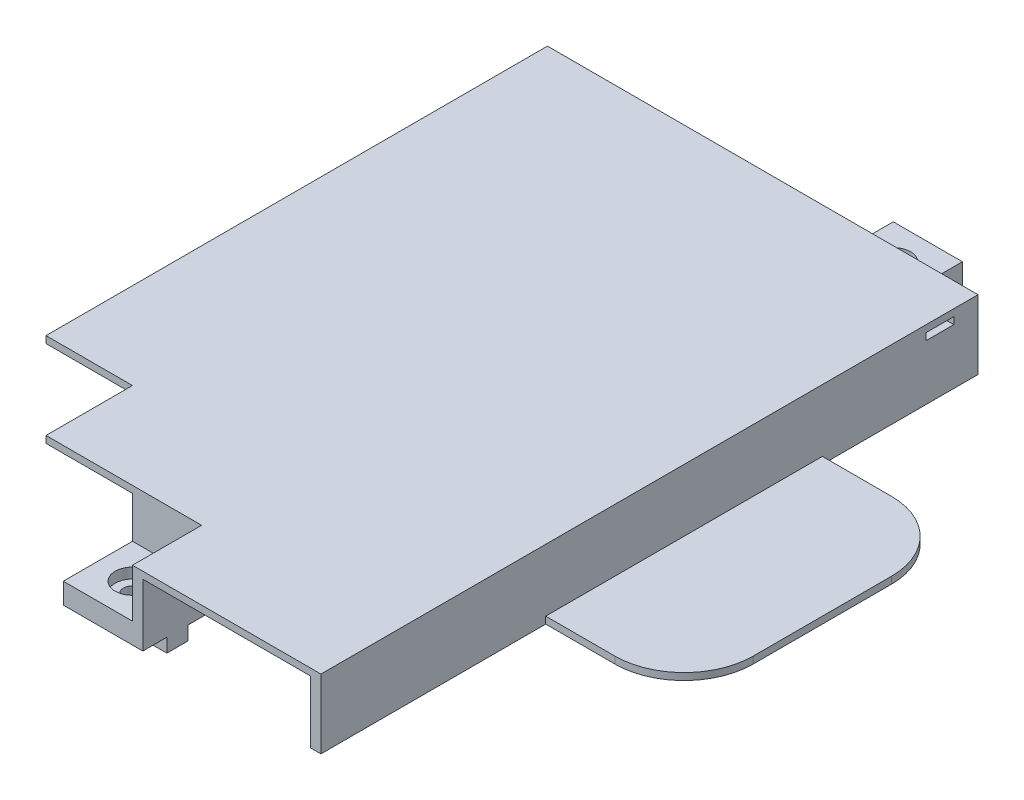
from build123d import *

# Parameters (mm, degrees)
SKETCH_1_W           = 180
SKETCH_1_H           = 170
EXTRUDE_1_DEPTH      = 2
SKETCH_2_W           = 180
SKETCH_2_H           = 2
SKETCH_2_W_2         = 2
SKETCH_2_H_2         = 166
EXTRUDE_2_DEPTH      = 18
SKETCH_4_W           = 20
SKETCH_4_H           = 20
EXTRUDE_3_DEPTH      = 20
SKETCH_5_W           = 20
SKETCH_5_H           = 20
CUT_EXTRUDE_1_DEPTH  = 14
SKETCH_6_W           = 176
SKETCH_6_H           = 166
SKETCH_6_W_2         = 174
SKETCH_6_H_2         = 164
EXTRUDE_4_DEPTH      = 18
SKETCH_7_W           = 20
SKETCH_7_H           = 20
EXTRUDE_5_DEPTH      = 6
SKETCH_8_W           = 3
SKETCH_8_H           = 164
SKETCH_8_H_2         = 3
CUT_EXTRUDE_2_DEPTH  = 18
SKETCH_9_W           = 77
SKETCH_9_H           = 3
CUT_EXTRUDE_3_DEPTH  = 18
SKETCH_10_W          = 25
SKETCH_10_H          = 25
CUT_EXTRUDE_4_DEPTH  = 18
SKETCH_11_W          = 6.95
SKETCH_11_H          = 6.1
EXTRUDE_6_DEPTH      = 4
CUT_EXTRUDE_5_DEPTH  = 6
CUT_EXTRUDE_START    = -3
SKETCH_13_R          = 5
SKETCH_13_R_2        = 2.6
CUT_EXTRUDE_6_DEPTH  = 3
CUT_EXTRUDE_7_DEPTH  = 3
SKETCH_15_R          = 2.6
CUT_EXTRUDE_8_DEPTH  = 3
SKETCH_16_W          = 6.1
SKETCH_16_H          = 6.95
EXTRUDE_7_DEPTH      = 4
CUT_EXTRUDE_9_DEPTH  = 6
SKETCH_18_R          = 5
SKETCH_18_R_2        = 2.6
CUT_EXTRUDE_10_DEPTH = 3
EXTRUDE_8_DEPTH      = 4
SKETCH_20_W          = 30
SKETCH_20_H          = 20
SKETCH_20_W_2        = 80
EXTRUDE_9_DEPTH      = 2
SKETCH_21_W          = 3
SKETCH_21_H          = 20
EXTRUDE_10_DEPTH     = 18
SKETCH_22_W          = 20
SKETCH_22_H          = 20
SKETCH_22_R          = 5
EXTRUDE_11_DEPTH     = 14
SKETCH_23_W          = 30
SKETCH_23_H          = 20
CUT_EXTRUDE_11_DEPTH = 14
SKETCH_24_W          = 20
SKETCH_24_H          = 20
EXTRUDE_12_DEPTH     = 2
SKETCH_25_W          = 20
SKETCH_25_H          = 3
CUT_EXTRUDE_12_DEPTH = 18
CUT_EXTRUDE_13_DEPTH = 18
SKETCH_27_W          = 3
SKETCH_27_H          = 20
EXTRUDE_13_DEPTH     = 20
SKETCH_28_W          = 23
SKETCH_28_H          = 3
EXTRUDE_14_DEPTH     = 20
SKETCH_29_W          = 3
SKETCH_29_H          = 5
CUT_EXTRUDE_14_DEPTH = 20
SKETCH_30_W          = 20
SKETCH_30_H          = 20
CUT_EXTRUDE_15_DEPTH = 30
SKETCH_31_W          = 3
SKETCH_31_H          = 190
EXTRUDE_15_DEPTH     = 20
EXTRUDE_START        = -2
EXTRUDE_16_DEPTH     = 2
SKETCH_33_W          = 40
SKETCH_33_H          = 80
CUT_EXTRUDE_16_DEPTH = 2
SKETCH_34_W          = 44.5
SKETCH_34_H          = 20
CUT_EXTRUDE_17_DEPTH = 30
SKETCH_35_W          = 20
SKETCH_35_H          = 3
CUT_EXTRUDE_18_DEPTH = 18
EXTRUDE_17_DEPTH     = 20
CUT_EXTRUDE_19_DEPTH = 20
SKETCH_38_R          = 5
CUT_EXTRUDE_20_DEPTH = 17
SKETCH_39_W          = 20
SKETCH_39_H          = 20
CUT_EXTRUDE_21_DEPTH = 14
SKETCH_40_W          = 54.5
SKETCH_40_H          = 20
EXTRUDE_18_DEPTH     = 2
SKETCH_42_W          = 3
SKETCH_42_H          = 23
EXTRUDE_20_DEPTH     = 18
SKETCH_44_W          = 9.95
SKETCH_44_H          = 6.1
SKETCH_44_W_2        = 6.95
EXTRUDE_21_DEPTH     = 4
SKETCH_45_W          = 26.378914519
SKETCH_45_H          = 21.149439528
CUT_EXTRUDE_22_DEPTH = 30
SKETCH_46_W          = 20
SKETCH_46_H          = 3
EXTRUDE_22_DEPTH     = 18
CUT_EXTRUDE_23_DEPTH = 30
SKETCH_48_W          = 47
SKETCH_48_H          = 3
CUT_EXTRUDE_24_DEPTH = 18
SKETCH_49_W          = 50.597895005
SKETCH_49_H          = 84.263639234
CUT_EXTRUDE_25_DEPTH = 2
SKETCH_50_W          = 48.5
SKETCH_50_H          = 3
CUT_EXTRUDE_26_DEPTH = 18
SKETCH_51_W          = 8
SKETCH_51_H          = 2
CUT_EXTRUDE_27_DEPTH = 18


with BuildPart() as part:
    # 草图1 → 凸台-拉伸1 (new body)
    with BuildSketch(Plane(origin=(0, 0, 0), x_dir=(1, 0, 0), z_dir=(0, 1, 0))):
        Rectangle(SKETCH_1_W, SKETCH_1_H)
    extrude_1 = extrude(amount=EXTRUDE_1_DEPTH)

    # 草图2 → 凸台-拉伸2 (add)
    with BuildSketch(Plane(origin=(0, 0, 0), x_dir=(1, 0, 0), z_dir=(0, 1, 0))):
        with Locations((0, 84)):
            Rectangle(SKETCH_2_W, SKETCH_2_H)
        Polygon((-88, 83), (-90, 83), (-90, -85), (-88, -85), (-88, -83), align=None)
        with Locations((89, 0)):
            Rectangle(SKETCH_2_W_2, SKETCH_2_H_2)
        Polygon((90, -85), (90, -83), (88, -83), (-88, -83), (-88, -85), align=None)
    extrude_2 = extrude(amount=-EXTRUDE_2_DEPTH)

    # 草图4 → 凸台-拉伸3 (add)
    with BuildSketch(Plane(origin=(0, 2, 0), x_dir=(1, 0, 0), z_dir=(0, 1, 0))):
        Polygon((10, -85), (0, -85), (-10, -85), (-10, -95), (-10, -105), (10, -105), (10, -95), align=None)
        with Locations((-100, 0)):
            Rectangle(SKETCH_4_W, SKETCH_4_H)
    extrude(amount=-EXTRUDE_3_DEPTH)

    # 草图5 → 切除-拉伸1 (cut)
    with BuildSketch(Plane(origin=(0, 2, 0), x_dir=(1, 0, 0), z_dir=(0, 1, 0))):
        with Locations((-100, 0)):
            Rectangle(SKETCH_5_W, SKETCH_5_H)
        with Locations((0, -95)):
            Rectangle(SKETCH_5_W, SKETCH_5_H)
    extrude(amount=-CUT_EXTRUDE_1_DEPTH, mode=Mode.SUBTRACT)

    # 草图6 → 凸台-拉伸4 (add)
    with BuildSketch(Plane.XZ):
        Rectangle(SKETCH_6_W, SKETCH_6_H)
        Rectangle(SKETCH_6_W_2, SKETCH_6_H_2, mode=Mode.SUBTRACT)
    extrude_4 = extrude(amount=EXTRUDE_4_DEPTH)

    # 草图7 → 凸台-拉伸5 (add)
    with BuildSketch(Plane(origin=(0, -18, 0), x_dir=(-1, 0, 0), z_dir=(0, -1, 0))):
        with Locations((0, 95)):
            Rectangle(SKETCH_7_W, SKETCH_7_H)
    extrude_5 = extrude(amount=-EXTRUDE_5_DEPTH)

    # 草图8 → 切除-拉伸2 (cut)
    with BuildSketch(Plane(origin=(0, -18, 0), x_dir=(-1, 0, 0), z_dir=(0, -1, 0))):
        with Locations((-88.5, 0)):
            Rectangle(SKETCH_8_W, SKETCH_8_H)
        with Locations((-88.5, -83.5)):
            Rectangle(SKETCH_8_W, SKETCH_8_H_2)
    extrude(amount=-CUT_EXTRUDE_2_DEPTH, mode=Mode.SUBTRACT)

    # 草图9 → 切除-拉伸3 (cut)
    with BuildSketch(Plane(origin=(0, -18, 0), x_dir=(-1, 0, 0), z_dir=(0, -1, 0))):
        with Locations((-48.5, -83.5)):
            Rectangle(SKETCH_9_W, SKETCH_9_H)
        with Locations((48.5, -83.5)):
            Rectangle(SKETCH_9_W, SKETCH_9_H)
    extrude(amount=-CUT_EXTRUDE_3_DEPTH, mode=Mode.SUBTRACT)

    # 草图10 → 切除-拉伸4 (cut)
    with BuildSketch(Plane(origin=(0, 2, 0), x_dir=(1, 0, 0), z_dir=(0, 1, 0))):
        with Locations((77.5, -72.5)):
            Rectangle(SKETCH_10_W, SKETCH_10_H)
    cut_extrude_4 = extrude(amount=-CUT_EXTRUDE_4_DEPTH, mode=Mode.SUBTRACT)

    # 草图11 → 凸台-拉伸6 (add)
    with BuildSketch(Plane(origin=(0, -18, 0), x_dir=(-1, 0, 0), z_dir=(0, -1, 0))):
        Polygon((-3.05, 91.95), (-3.05, 98.05), (-10, 98.05), (-10, 95), (-10, 91.95), align=None)
        with Locations((6.525, 95)):
            Rectangle(SKETCH_11_W, SKETCH_11_H)
    extrude_6 = extrude(amount=EXTRUDE_6_DEPTH)

    # 草图12 → 切除-拉伸5 (cut)
    with BuildSketch(Plane(origin=(0, -18, 0), x_dir=(-1, 0, 0), z_dir=(0, -1, 0))):
        with BuildLine():
            ThreePointArc((-1.838477631, 96.838477631), (-1.838477631, 93.161522369), (1.838477631, 93.161522369))
            Line((1.838477631, 93.161522369), (-1.838477631, 96.838477631))
        make_face()
        with BuildLine():
            Line((-1.838477631, 96.838477631), (1.838477631, 93.161522369))
            ThreePointArc((1.838477631, 93.161522369), (2.402086785, 94.005023076), (2.6, 95))
            ThreePointArc((2.6, 95), (0.994976924, 97.402086785), (-1.838477631, 96.838477631))
        make_face()
    cut_extrude_5 = extrude(amount=-CUT_EXTRUDE_5_DEPTH, mode=Mode.SUBTRACT)

    # 草图13 → 切除-拉伸6 (cut)
    with BuildSketch(Plane(origin=(0, -12, 0), x_dir=(1, 0, 0), z_dir=(0, 1, 0)).offset(CUT_EXTRUDE_START)):
        with Locations(Location((0, 95, 0), (0, 0, 270))):
            Circle(SKETCH_13_R)
        with Locations(Location((0, 95, 0), (0, 0, 90))):
            Circle(SKETCH_13_R_2, mode=Mode.SUBTRACT)
    cut_extrude_6 = extrude(amount=CUT_EXTRUDE_6_DEPTH, mode=Mode.SUBTRACT)

    # 草图14 → 切除-拉伸7 (cut)
    with BuildSketch(Plane(origin=(0, -12, 0), x_dir=(1, 0, 0), z_dir=(0, 1, 0))):
        with BuildLine():
            ThreePointArc((-96.464466094, 3.535533906), (-103.535533906, 3.535533906), (-103.535533906, -3.535533906))
            Line((-103.535533906, -3.535533906), (-96.464466094, 3.535533906))
        make_face()
        with BuildLine():
            Line((-96.464466094, 3.535533906), (-103.535533906, -3.535533906))
            ThreePointArc((-103.535533906, -3.535533906), (-98.086582838, -4.619397663), (-95, 0))
            ThreePointArc((-95, 0), (-95.380602337, 1.913417162), (-96.464466094, 3.535533906))
        make_face()
    extrude(amount=-CUT_EXTRUDE_7_DEPTH, mode=Mode.SUBTRACT)

    # 草图15 → 切除-拉伸8 (cut)
    with BuildSketch(Plane(origin=(0, -15, 0), x_dir=(1, 0, 0), z_dir=(0, 1, 0))):
        with Locations(Location((-100, 0, 0), (0, 0, 270))):
            Circle(SKETCH_15_R)
    extrude(amount=-CUT_EXTRUDE_8_DEPTH, mode=Mode.SUBTRACT)

    # 草图16 → 凸台-拉伸7 (add)
    with BuildSketch(Plane.XZ.offset(18)):
        Polygon((-96.95, -3.05), (-100, -3.05), (-103.05, -3.05), (-103.05, -10), (-96.95, -10), align=None)
        with Locations((-100, 6.525)):
            Rectangle(SKETCH_16_W, SKETCH_16_H)
    extrude(amount=EXTRUDE_7_DEPTH)

    # 草图17 → 切除-拉伸9 (cut)
    with BuildSketch(Plane(origin=(0, -18, 0), x_dir=(-1, 0, 0), z_dir=(0, -1, 0))):
        with BuildLine():
            ThreePointArc((2.6, -95), (0.994976924, -92.597913215), (-1.838477631, -93.161522369))
            Line((-1.838477631, -93.161522369), (1.838477631, -96.838477631))
            ThreePointArc((1.838477631, -96.838477631), (2.402086785, -95.994976924), (2.6, -95))
        make_face()
        with BuildLine():
            Line((1.838477631, -96.838477631), (-1.838477631, -93.161522369))
            ThreePointArc((-1.838477631, -93.161522369), (-1.838477631, -96.838477631), (1.838477631, -96.838477631))
        make_face()
    extrude(amount=-CUT_EXTRUDE_9_DEPTH, mode=Mode.SUBTRACT)

    # 草图18 → 切除-拉伸10 (cut)
    with BuildSketch(Plane(origin=(0, -12, 0), x_dir=(1, 0, 0), z_dir=(0, 1, 0)).offset(CUT_EXTRUDE_START)):
        with Locations(Location((0, -95, 0), (0, 0, 270))):
            Circle(SKETCH_18_R)
        with Locations(Location((0, -95, 0), (0, 0, 90))):
            Circle(SKETCH_18_R_2, mode=Mode.SUBTRACT)
    extrude(amount=CUT_EXTRUDE_10_DEPTH, mode=Mode.SUBTRACT)

    # 草图19 → 凸台-拉伸8 (add)
    with BuildSketch(Plane(origin=(0, -18, 0), x_dir=(-1, 0, 0), z_dir=(0, -1, 0))):
        Polygon((3.05, -91.95), (3.05, -95), (3.05, -98.05), (10, -98.05), (10, -91.95), align=None)
        Polygon((-3.05, -98.05), (-3.05, -95), (-3.05, -91.95), (-10, -91.95), (-10, -98.05), align=None)
    extrude(amount=EXTRUDE_8_DEPTH)

    # 草图20 → 凸台-拉伸9 (add)
    with BuildSketch(Plane(origin=(0, 2, 0), x_dir=(1, 0, 0), z_dir=(0, 1, 0))):
        with Locations((25, -95)):
            Rectangle(SKETCH_20_W, SKETCH_20_H)
        with Locations((-50, -95)):
            Rectangle(SKETCH_20_W_2, SKETCH_20_H)
    extrude(amount=-EXTRUDE_9_DEPTH)

    # 草图21 → 凸台-拉伸10 (add)
    with BuildSketch(Plane(origin=(0, 0, 0), x_dir=(-1, 0, 0), z_dir=(0, -1, 0))):
        with Locations((88.5, -95)):
            Rectangle(SKETCH_21_W, SKETCH_21_H)
    extrude(amount=EXTRUDE_10_DEPTH)

    # 草图22 → 凸台-拉伸11 (add)
    with BuildSketch(Plane(origin=(0, -12, 0), x_dir=(1, 0, 0), z_dir=(0, 1, 0))):
        with Locations((0, -95)):
            Rectangle(SKETCH_22_W, SKETCH_22_H)
        with Locations(Location((0, -95, 0), (0, 0, 270))):
            Circle(SKETCH_22_R, mode=Mode.SUBTRACT)
    extrude(amount=EXTRUDE_11_DEPTH)

    # 草图23 → 切除-拉伸11 (cut)
    with BuildSketch(Plane(origin=(0, 0, 0), x_dir=(-1, 0, 0), z_dir=(0, -1, 0))):
        with Locations((-25, -95)):
            Rectangle(SKETCH_23_W, SKETCH_23_H)
    extrude(amount=-CUT_EXTRUDE_11_DEPTH, mode=Mode.SUBTRACT)

    # 草图24 → 凸台-拉伸12 (add)
    with BuildSketch(Plane(origin=(0, 2, 0), x_dir=(1, 0, 0), z_dir=(0, 1, 0))):
        with Locations((80, 95)):
            Rectangle(SKETCH_24_W, SKETCH_24_H)
    extrude(amount=-EXTRUDE_12_DEPTH)

    # 草图25 → 切除-拉伸12 (cut)
    with BuildSketch(Plane(origin=(0, -18, 0), x_dir=(-1, 0, 0), z_dir=(0, -1, 0))):
        with Locations((-80, 83.5)):
            Rectangle(SKETCH_25_W, SKETCH_25_H)
    extrude(amount=-CUT_EXTRUDE_12_DEPTH, mode=Mode.SUBTRACT)

    # 草图26 → 切除-拉伸13 (cut)
    with BuildSketch(Plane.XZ):
        with BuildLine():
            ThreePointArc((90, -88), (83, -95), (90, -102))
            Line((90, -102), (90, -95))
            Line((90, -95), (90, -88))
        make_face()
    extrude(amount=-CUT_EXTRUDE_13_DEPTH, mode=Mode.SUBTRACT)

    # 草图27 → 凸台-拉伸13 (add)
    with BuildSketch(Plane(origin=(0, 2, 0), x_dir=(1, 0, 0), z_dir=(0, 1, 0))):
        with Locations((68.5, 95)):
            Rectangle(SKETCH_27_W, SKETCH_27_H)
    extrude(amount=-EXTRUDE_13_DEPTH)

    # 草图28 → 凸台-拉伸14 (add)
    with BuildSketch(Plane(origin=(0, 2, 0), x_dir=(1, 0, 0), z_dir=(0, 1, 0))):
        with Locations((78.5, 103.5)):
            Rectangle(SKETCH_28_W, SKETCH_28_H)
    extrude(amount=-EXTRUDE_14_DEPTH)

    # 草图29 → 切除-拉伸14 (cut)
    with BuildSketch(Plane(origin=(0, 2, 0), x_dir=(1, 0, 0), z_dir=(0, 1, 0))):
        with Locations((88.5, 102.5)):
            Rectangle(SKETCH_29_W, SKETCH_29_H)
    extrude(amount=-CUT_EXTRUDE_14_DEPTH, mode=Mode.SUBTRACT)

    # 草图30 → 切除-拉伸15 (cut)
    with BuildSketch(Plane(origin=(0, 2, 0), x_dir=(1, 0, 0), z_dir=(0, 1, 0))):
        with BuildLine():
            Line((-34.5, 40), (-34.5, 85))
            Line((-34.5, 85), (-90, 85))
            Line((-90, 85), (-90, 10))
            Line((-90, 10), (-90, -10))
            Line((-90, -10), (-90, -105))
            Line((-90, -105), (-34.5, -105))
            Line((-34.5, -105), (-34.5, -85))
            Line((-34.5, -85), (-34.5, -40))
            Line((-34.5, -40), (-54.5, -40))
            ThreePointArc((-54.5, -40), (-68.642135624, -34.142135624), (-74.5, -20))
            Line((-74.5, -20), (-74.5, 20))
            ThreePointArc((-74.5, 20), (-68.642135624, 34.142135624), (-54.5, 40))
            Line((-54.5, 40), (-34.5, 40))
        make_face()
        with Locations((-100, 0)):
            Rectangle(SKETCH_30_W, SKETCH_30_H)
    cut_extrude_15 = extrude(amount=-CUT_EXTRUDE_15_DEPTH, mode=Mode.SUBTRACT)

    # 草图31 → 凸台-拉伸15 (add)
    with BuildSketch(Plane(origin=(0, 2, 0), x_dir=(1, 0, 0), z_dir=(0, 1, 0))):
        with Locations((-33, -10)):
            Rectangle(SKETCH_31_W, SKETCH_31_H)
    extrude_15 = extrude(amount=-EXTRUDE_15_DEPTH)

    # 草图32 → 凸台-拉伸16 (add)
    with BuildSketch(Plane(origin=(0, -18, 0), x_dir=(-1, 0, 0), z_dir=(0, -1, 0)).offset(EXTRUDE_START)):
        with BuildLine():
            Line((34.5, -40), (54.5, -40))
            ThreePointArc((54.5, -40), (68.642135624, -34.142135624), (74.5, -20))
            Line((74.5, -20), (74.5, 20))
            ThreePointArc((74.5, 20), (68.642135624, 34.142135624), (54.5, 40))
            Line((54.5, 40), (34.5, 40))
            Line((34.5, 40), (34.5, -40))
        make_face()
    extrude_16 = extrude(amount=EXTRUDE_16_DEPTH)

    # 草图33 → 切除-拉伸16 (cut)
    with BuildSketch(Plane(origin=(0, 2, 0), x_dir=(1, 0, 0), z_dir=(0, 1, 0))):
        with Locations((-54.5, 0)):
            Rectangle(SKETCH_33_W, SKETCH_33_H)
    extrude(amount=-CUT_EXTRUDE_16_DEPTH, mode=Mode.SUBTRACT)

    # 草图34 → 切除-拉伸17 (cut)
    with BuildSketch(Plane(origin=(0, 2, 0), x_dir=(1, 0, 0), z_dir=(0, 1, 0))):
        with Locations((-12.25, -95)):
            Rectangle(SKETCH_34_W, SKETCH_34_H)
    extrude(amount=-CUT_EXTRUDE_17_DEPTH, mode=Mode.SUBTRACT)

    # 草图35 → 切除-拉伸18 (cut)
    with BuildSketch(Plane(origin=(0, -18, 0), x_dir=(-1, 0, 0), z_dir=(0, -1, 0))):
        with Locations((0, -83.5)):
            Rectangle(SKETCH_35_W, SKETCH_35_H)
    extrude(amount=-CUT_EXTRUDE_18_DEPTH, mode=Mode.SUBTRACT)

    # 草图36 → 凸台-拉伸17 (add)
    with BuildSketch(Plane(origin=(0, 2, 0), x_dir=(1, 0, 0), z_dir=(0, 1, 0))):
        Polygon((40, -105), (40, -85), (40, -82), (20, -82), (20, -85), (20, -105), align=None)
    extrude_17 = extrude(amount=-EXTRUDE_17_DEPTH)

    # 草图37 → 切除-拉伸19 (cut)
    with BuildSketch(Plane(origin=(0, 2, 0), x_dir=(1, 0, 0), z_dir=(0, 1, 0))):
        with BuildLine():
            ThreePointArc((32.6, -95), (30.994976924, -92.597913215), (28.161522369, -93.161522369))
            Line((28.161522369, -93.161522369), (31.838477631, -96.838477631))
            ThreePointArc((31.838477631, -96.838477631), (32.402086785, -95.994976924), (32.6, -95))
        make_face()
        with BuildLine():
            Line((31.838477631, -96.838477631), (28.161522369, -93.161522369))
            ThreePointArc((28.161522369, -93.161522369), (28.161522369, -96.838477631), (31.838477631, -96.838477631))
        make_face()
    cut_extrude_19 = extrude(amount=-CUT_EXTRUDE_19_DEPTH, mode=Mode.SUBTRACT)

    # 草图38 → 切除-拉伸20 (cut)
    with BuildSketch(Plane(origin=(0, 2, 0), x_dir=(1, 0, 0), z_dir=(0, 1, 0))):
        with Locations(Location((30, -95, 0), (0, 0, 270))):
            Circle(SKETCH_38_R)
    cut_extrude_20 = extrude(amount=-CUT_EXTRUDE_20_DEPTH, mode=Mode.SUBTRACT)

    # 草图39 → 切除-拉伸21 (cut)
    with BuildSketch(Plane(origin=(0, 2, 0), x_dir=(1, 0, 0), z_dir=(0, 1, 0))):
        with Locations((30, -95)):
            Rectangle(SKETCH_39_W, SKETCH_39_H)
    cut_extrude_21 = extrude(amount=-CUT_EXTRUDE_21_DEPTH, mode=Mode.SUBTRACT)

    # 草图40 → 凸台-拉伸18 (add)
    with BuildSketch(Plane(origin=(0, 2, 0), x_dir=(1, 0, 0), z_dir=(0, 1, 0))):
        with Locations((-7.25, -95)):
            Rectangle(SKETCH_40_W, SKETCH_40_H)
    extrude_18 = extrude(amount=-EXTRUDE_18_DEPTH)

    # 草图42 → 凸台-拉伸20 (add)
    with BuildSketch(Plane(origin=(0, -18, 0), x_dir=(-1, 0, 0), z_dir=(0, -1, 0))):
        with Locations((-18.5, -93.5)):
            Rectangle(SKETCH_42_W, SKETCH_42_H)
    extrude_20 = extrude(amount=-EXTRUDE_20_DEPTH)

    # 草图44 → 凸台-拉伸21 (add)
    with BuildSketch(Plane(origin=(0, -18, 0), x_dir=(-1, 0, 0), z_dir=(0, -1, 0))):
        with Locations((-21.975, -95)):
            Rectangle(SKETCH_44_W, SKETCH_44_H)
        with Locations((-36.525, -95)):
            Rectangle(SKETCH_44_W_2, SKETCH_44_H)
    extrude_21 = extrude(amount=EXTRUDE_21_DEPTH)

    # 草图45 → 切除-拉伸22 (cut)
    with BuildSketch(Plane(origin=(0, 2, 0), x_dir=(1, 0, 0), z_dir=(0, 1, 0))):
        with Locations((80.18945726, 95.574719764)):
            Rectangle(SKETCH_45_W, SKETCH_45_H)
    extrude(amount=-CUT_EXTRUDE_22_DEPTH, mode=Mode.SUBTRACT)

    # 草图46 → 凸台-拉伸22 (add)
    with BuildSketch(Plane(origin=(0, 0, 0), x_dir=(-1, 0, 0), z_dir=(0, -1, 0))):
        with Locations((-80, 83.5)):
            Rectangle(SKETCH_46_W, SKETCH_46_H)
    extrude(amount=EXTRUDE_22_DEPTH)

    # 镜向1: 凸台-拉伸1, 凸台-拉伸2, 凸台-拉伸4, 凸台-拉伸5, 切除-拉伸4, 凸台-拉伸6, 切除-拉伸5, 切除-拉伸6, 切除-拉伸15, 凸台-拉伸15, 凸台-拉伸16, 凸台-拉伸17, 切除-拉伸19, 切除-拉伸20, 切除-拉伸21, 凸台-拉伸18, 凸台-拉伸20, 凸台-拉伸21 across plane
    add(extrude_1.mirror(Plane(origin=(90, 2, 85), x_dir=(0, 0, 1), z_dir=(-1, 0, 0))))
    add(extrude_2.mirror(Plane(origin=(90, 2, 85), x_dir=(0, 0, 1), z_dir=(-1, 0, 0))))
    add(extrude_4.mirror(Plane(origin=(90, 2, 85), x_dir=(0, 0, 1), z_dir=(-1, 0, 0))))
    add(extrude_5.mirror(Plane(origin=(90, 2, 85), x_dir=(0, 0, 1), z_dir=(-1, 0, 0))))
    add(cut_extrude_4.mirror(Plane(origin=(90, 2, 85), x_dir=(0, 0, 1), z_dir=(-1, 0, 0))), mode=Mode.SUBTRACT)
    add(extrude_6.mirror(Plane(origin=(90, 2, 85), x_dir=(0, 0, 1), z_dir=(-1, 0, 0))))
    add(cut_extrude_5.mirror(Plane(origin=(90, 2, 85), x_dir=(0, 0, 1), z_dir=(-1, 0, 0))), mode=Mode.SUBTRACT)
    add(cut_extrude_6.mirror(Plane(origin=(90, 2, 85), x_dir=(0, 0, 1), z_dir=(-1, 0, 0))), mode=Mode.SUBTRACT)
    add(cut_extrude_15.mirror(Plane(origin=(90, 2, 85), x_dir=(0, 0, 1), z_dir=(-1, 0, 0))), mode=Mode.SUBTRACT)
    add(extrude_15.mirror(Plane(origin=(90, 2, 85), x_dir=(0, 0, 1), z_dir=(-1, 0, 0))))
    add(extrude_16.mirror(Plane(origin=(90, 2, 85), x_dir=(0, 0, 1), z_dir=(-1, 0, 0))))
    add(extrude_17.mirror(Plane(origin=(90, 2, 85), x_dir=(0, 0, 1), z_dir=(-1, 0, 0))))
    add(cut_extrude_19.mirror(Plane(origin=(90, 2, 85), x_dir=(0, 0, 1), z_dir=(-1, 0, 0))), mode=Mode.SUBTRACT)
    add(cut_extrude_20.mirror(Plane(origin=(90, 2, 85), x_dir=(0, 0, 1), z_dir=(-1, 0, 0))), mode=Mode.SUBTRACT)
    add(cut_extrude_21.mirror(Plane(origin=(90, 2, 85), x_dir=(0, 0, 1), z_dir=(-1, 0, 0))), mode=Mode.SUBTRACT)
    add(extrude_18.mirror(Plane(origin=(90, 2, 85), x_dir=(0, 0, 1), z_dir=(-1, 0, 0))))
    add(extrude_20.mirror(Plane(origin=(90, 2, 85), x_dir=(0, 0, 1), z_dir=(-1, 0, 0))))
    add(extrude_21.mirror(Plane(origin=(90, 2, 85), x_dir=(0, 0, 1), z_dir=(-1, 0, 0))))

    # 草图47 → 切除-拉伸23 (cut)
    with BuildSketch(Plane(origin=(0, 2, 0), x_dir=(1, 0, 0), z_dir=(0, 1, 0))):
        Polygon((-85.012299468, 85), (-34.5, 85), (90, 85), (90, 116.288781381), (-85.012299468, 116.288781381), align=None)
        Polygon((90, 85), (-34.5, 85), (-34.5, -105), (20, -105), (20, -85), (65, -85), (65, -60), (90, -60), align=None)
        Polygon((-34.5, -105), (-34.5, 85), (-85.012299468, 85), (-85.012299468, -142.465339739), (90, -142.465339739), (90, -60), (65, -60), (65, -85), (20, -85), (20, -105), align=None)
    extrude(amount=-CUT_EXTRUDE_23_DEPTH, mode=Mode.SUBTRACT)

    # 草图48 → 切除-拉伸24 (cut)
    with BuildSketch(Plane.XZ.offset(18)):
        Polygon((90, -82), (93, -82), (93, 82), (93, 85), (90, 85), align=None)
        with Locations((116.5, 83.5)):
            Rectangle(SKETCH_48_W, SKETCH_48_H)
    extrude(amount=-CUT_EXTRUDE_24_DEPTH, mode=Mode.SUBTRACT)

    # 草图49 → 切除-拉伸25 (cut)
    with BuildSketch(Plane(origin=(0, 2, 0), x_dir=(1, 0, 0), z_dir=(0, 1, 0))):
        with Locations((239.798947502, 2.131819617)):
            Rectangle(SKETCH_49_W, SKETCH_49_H)
    extrude(amount=-CUT_EXTRUDE_25_DEPTH, mode=Mode.SUBTRACT)

    # 草图50 → 切除-拉伸26 (cut)
    with BuildSketch(Plane(origin=(0, -18, 0), x_dir=(-1, 0, 0), z_dir=(0, -1, 0))):
        with Locations((-187.25, -83.5)):
            Rectangle(SKETCH_50_W, SKETCH_50_H)
    extrude(amount=-CUT_EXTRUDE_26_DEPTH, mode=Mode.SUBTRACT)

    # 草图51 → 切除-拉伸27 (cut)
    with BuildSketch(Plane(origin=(214.5, 0, 0), x_dir=(0, 0, -1), z_dir=(1, 0, 0))):
        with Locations((74, -1)):
            Rectangle(SKETCH_51_W, SKETCH_51_H)
    extrude(amount=-CUT_EXTRUDE_27_DEPTH, mode=Mode.SUBTRACT)


solid = part.part
